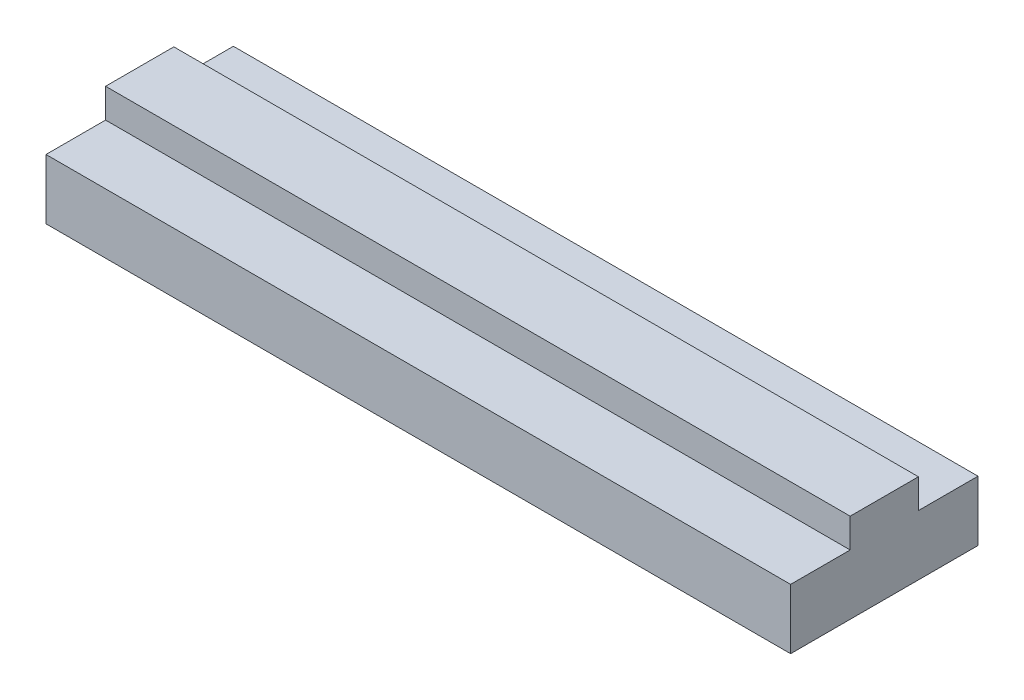
from build123d import *

# Parameters (mm, degrees)
SKETCH1_W           = 150
SKETCH1_H           = 37.75
BOSS_EXTRUDE1_DEPTH = 18
SKETCH2_W           = 12
SKETCH2_H           = 5.9
CUT_EXTRUDE1_DEPTH  = 150
SKETCH3_W           = 12
SKETCH3_H           = 5.9
CUT_EXTRUDE2_DEPTH  = 150
SKETCH4_W           = 140.2
SKETCH4_H           = 10.2
CUT_EXTRUDE3_DEPTH  = 7.5


with BuildPart() as part:
    # Sketch1 → Boss-Extrude1 (new body)
    with BuildSketch(Plane(origin=(0, 0, 0), x_dir=(1, 0, 0), z_dir=(0, 1, 0))):
        Rectangle(SKETCH1_W, SKETCH1_H)
    extrude(amount=BOSS_EXTRUDE1_DEPTH)

    # Sketch2 → Cut-Extrude1 (cut)
    with BuildSketch(Plane(origin=(75, 0, 0), x_dir=(0, 0, -1), z_dir=(1, 0, 0))):
        with Locations((-12.875, 15.05)):
            Rectangle(SKETCH2_W, SKETCH2_H)
    extrude(amount=-CUT_EXTRUDE1_DEPTH, mode=Mode.SUBTRACT)

    # Sketch3 → Cut-Extrude2 (cut)
    with BuildSketch(Plane(origin=(75, 0, 0), x_dir=(0, 0, -1), z_dir=(1, 0, 0))):
        with Locations((12.875, 15.05)):
            Rectangle(SKETCH3_W, SKETCH3_H)
    extrude(amount=-CUT_EXTRUDE2_DEPTH, mode=Mode.SUBTRACT)

    # Sketch4 → Cut-Extrude3 (cut)
    with BuildSketch(Plane.XZ):
        Rectangle(SKETCH4_W, SKETCH4_H)
    extrude(amount=-CUT_EXTRUDE3_DEPTH, mode=Mode.SUBTRACT)


solid = part.part
